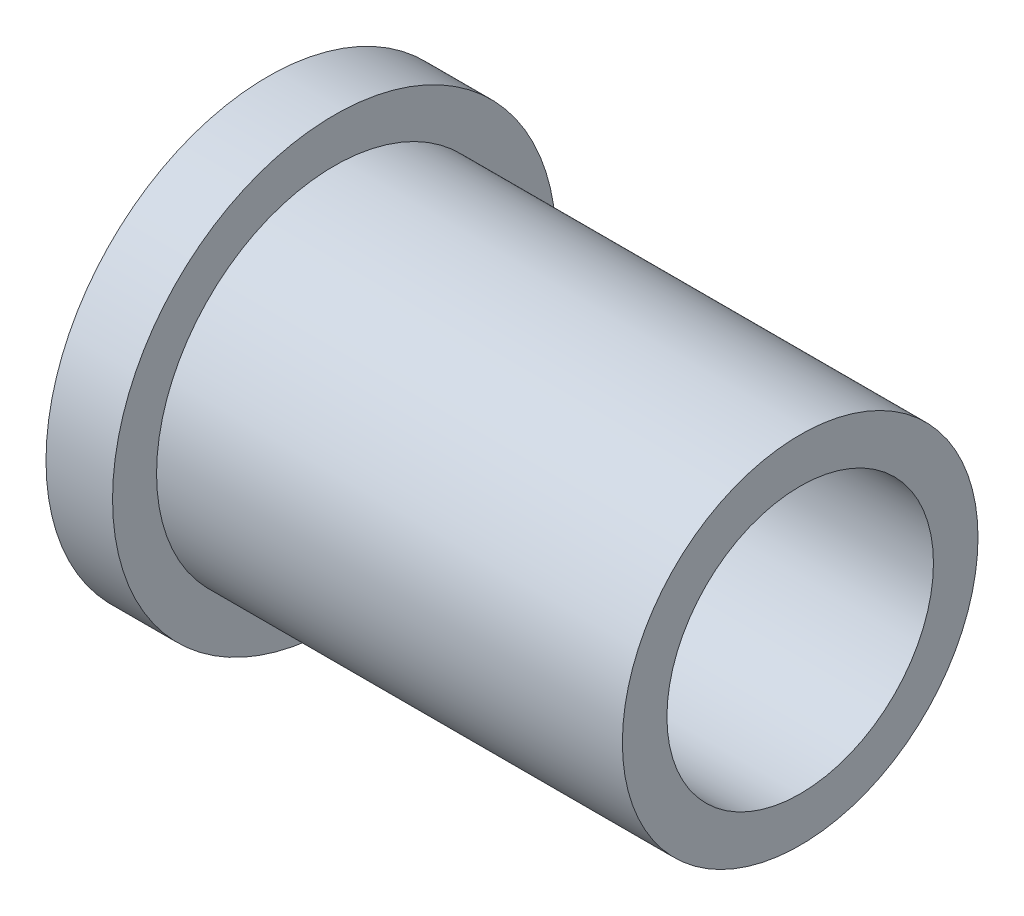
from build123d import *

# Parameters (mm, degrees)
SKETCH1_R           = 15.875
SKETCH1_R_2         = 9.5377
BOSS_EXTRUDE1_DEPTH = 4.7625
SKETCH1_3_R         = 12.7254
SKETCH1_3_R_2       = 9.5377
BOSS_EXTRUDE2_DEPTH = 38.1


with BuildPart() as part:
    # Sketch1 → Boss-Extrude1 (new body)
    with BuildSketch(Plane(origin=(0, 0, 0), x_dir=(0, 0, -1), z_dir=(1, 0, 0))):
        Circle(SKETCH1_R)
        Circle(SKETCH1_R_2, mode=Mode.SUBTRACT)
    extrude(amount=BOSS_EXTRUDE1_DEPTH)

    # Sketch1<3> → Boss-Extrude2 (add)
    with BuildSketch(Plane(origin=(0, 0, 0), x_dir=(0, 0, -1), z_dir=(1, 0, 0))):
        Circle(SKETCH1_3_R)
        Circle(SKETCH1_3_R_2, mode=Mode.SUBTRACT)
    extrude(amount=BOSS_EXTRUDE2_DEPTH)


solid = part.part
